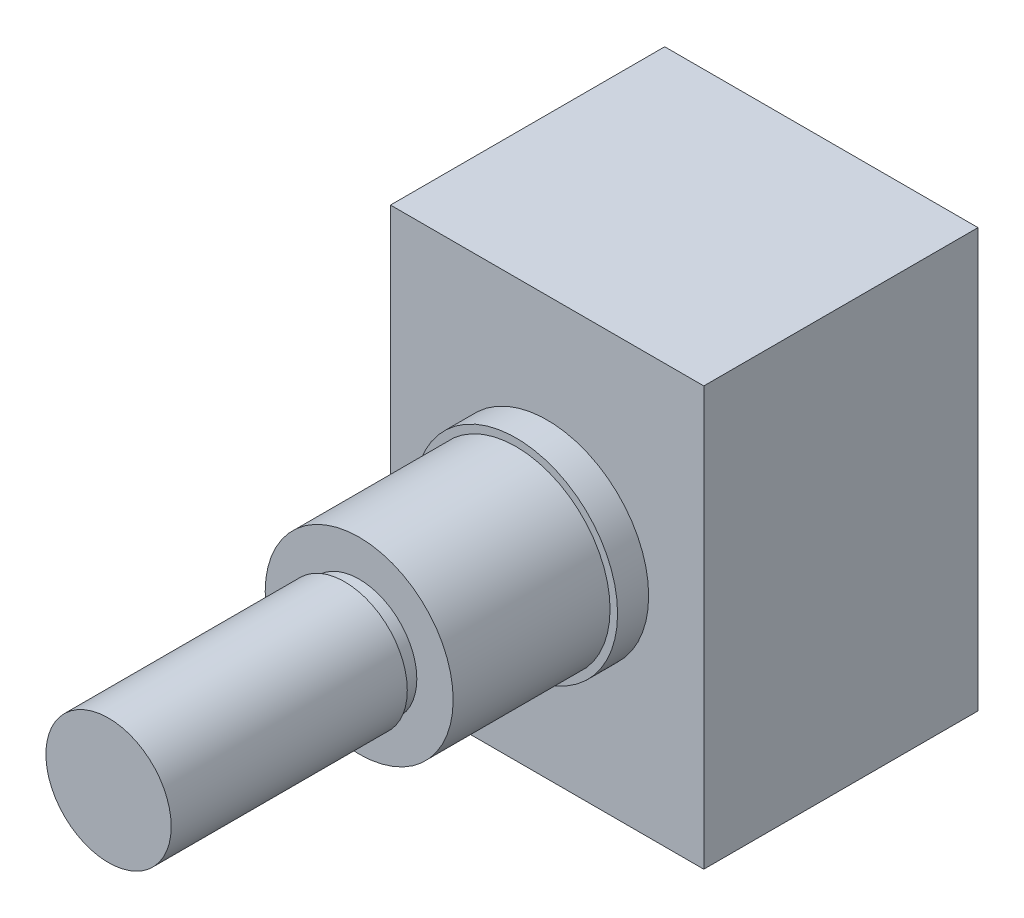
from build123d import *

# Parameters (mm, degrees)
SKETCH1_W           = 15.875
SKETCH1_H           = 21.209
BOSS_EXTRUDE1_DEPTH = 13.8938
SKETCH2_R           = 5.1435
BOSS_EXTRUDE2_DEPTH = 1.5748
SKETCH3_R           = 4.7625
BOSS_EXTRUDE3_DEPTH = 9.525
SKETCH4_R           = 3.175
BOSS_EXTRUDE4_DEPTH = 22.225
SKETCH5_W           = 0.254
SKETCH5_H           = 0.7366


with BuildPart() as part:
    # Sketch1 → Boss-Extrude1 (new body)
    with BuildSketch(Plane.XY):
        Rectangle(SKETCH1_W, SKETCH1_H)
    extrude(amount=BOSS_EXTRUDE1_DEPTH)

    # Sketch2 → Boss-Extrude2 (add)
    with BuildSketch(Plane.XY.offset(13.8938)):
        with Locations(Location((0, 0, 0), (0, 0, 180))):
            Circle(SKETCH2_R)
    extrude(amount=BOSS_EXTRUDE2_DEPTH)

    # Sketch3 → Boss-Extrude3 (add)
    with BuildSketch(Plane.XY.offset(13.8938)):
        with Locations(Location((0, 0, 0), (0, 0, 180))):
            Circle(SKETCH3_R)
    extrude(amount=BOSS_EXTRUDE3_DEPTH)

    # Sketch4 → Boss-Extrude4 (add)
    with BuildSketch(Plane.XY.offset(13.8938)):
        Circle(SKETCH4_R)
    extrude(amount=BOSS_EXTRUDE4_DEPTH)

    # Sketch5 → Cut-Revolve1 (revolve, cut)
    with BuildSketch(Plane(origin=(0, 0, 0), x_dir=(1, 0, 0), z_dir=(0, 1, 0))):
        with Locations((3.048, -23.7871)):
            Rectangle(SKETCH5_W, SKETCH5_H)
    revolve(axis=Axis((0, 0, 36.1188), (0, 0, -1)), mode=Mode.SUBTRACT)


solid = part.part
